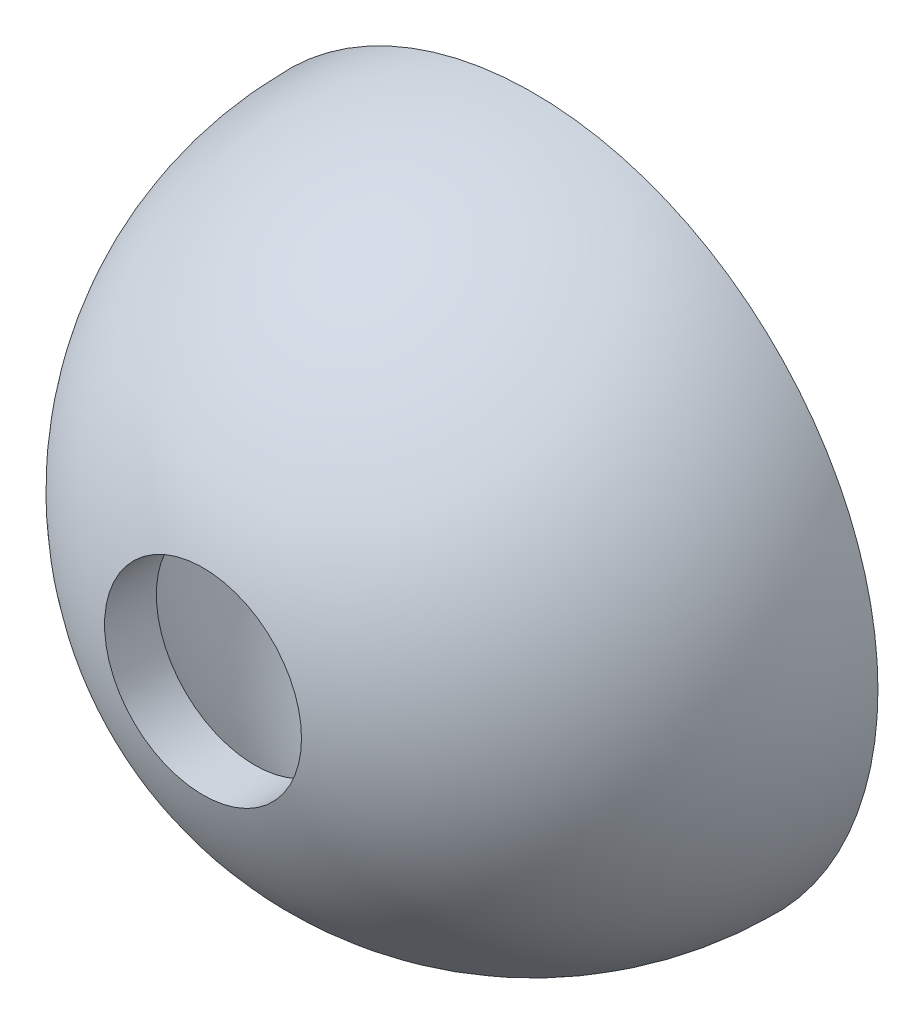
from build123d import *


with BuildPart() as part:
    # Sketch2 → Revolve1 (revolve)
    with BuildSketch(Plane(origin=(0, 0, 0), x_dir=(1, 0, 0), z_dir=(0, 1, 0))):
        with BuildLine():
            Line((7, 0), (6, 0))
            ThreePointArc((6, 0), (4.898979486, -3.464101615), (2, -5.656854249))
            Line((2, -5.656854249), (2, -6.708203932))
            ThreePointArc((2, -6.708203932), (5.61248608, -4.183300133), (7, 0))
        make_face()
    revolve(axis=Axis((0, 0, 12.379123454), (0, 0, -1)))


solid = part.part
